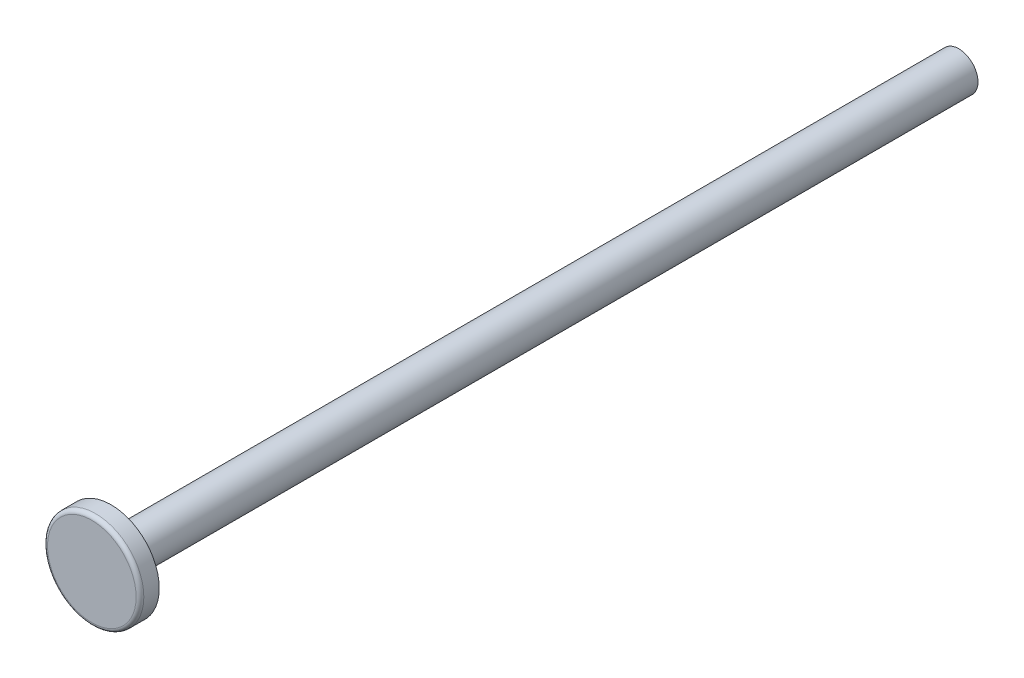
from build123d import *

# Parameters (mm, degrees)
SKETCH1_R           = 5
BOSS_EXTRUDE1_DEPTH = 110
SKETCH2_R           = 12.5
BOSS_EXTRUDE2_DEPTH = 5
FILLET1_R           = 1


with BuildPart() as part:
    # Sketch1 → Boss-Extrude1 (new, symmetric)
    with BuildSketch(Plane.XY):
        Circle(SKETCH1_R)
    extrude(amount=BOSS_EXTRUDE1_DEPTH, both=True)

    # Sketch2 → Boss-Extrude2 (add)
    with BuildSketch(Plane.XY.offset(110)):
        Circle(SKETCH2_R)
    extrude(amount=BOSS_EXTRUDE2_DEPTH)

    # Fillet1
    fillet1_edges = [part.edges().sort_by_distance(p)[0] for p in [
        (-12.5, 0, 115),
    ]]
    fillet(fillet1_edges, radius=FILLET1_R)


solid = part.part
